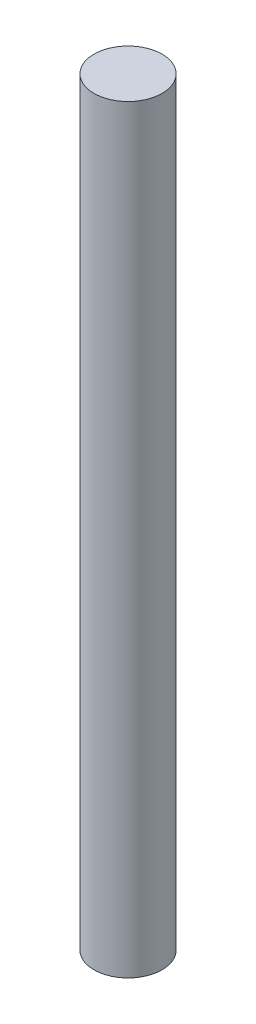
from build123d import *

# Parameters (mm, degrees)
SKETCH1_W = 1.3
SKETCH1_H = 29


with BuildPart() as part:
    # Sketch1 → Tendon (revolve)
    with BuildSketch(Plane.XY, mode=Mode.PRIVATE) as tendon_sk:
        with Locations((0.65, -14.5)):
            Rectangle(SKETCH1_W, SKETCH1_H)
    revolve(tendon_sk.sketch.rotate(Axis((0, -33, 0), (0, 1, 0)), 90), axis=Axis((0, -33, 0), (0, 1, 0)))


solid = part.part
